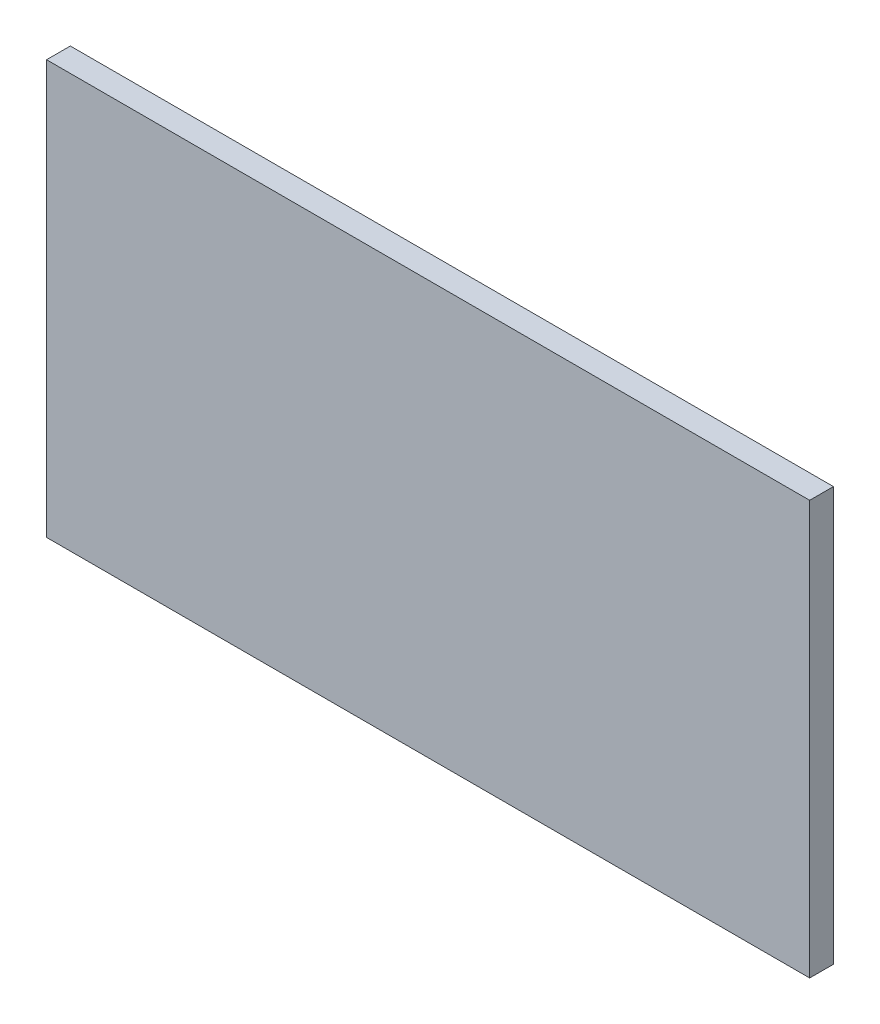
from build123d import *

# Parameters (mm, degrees)
SKETCH_1_W      = 81.566351119
SKETCH_1_H      = 44.220481928
EXTRUDE_1_DEPTH = 2.54


with BuildPart() as part:
    # 草圖1 → 填料-伸長1 (new body)
    with BuildSketch(Plane.XY):
        with Locations((19.237102703, 4.83080895)):
            Rectangle(SKETCH_1_W, SKETCH_1_H)
    extrude(amount=EXTRUDE_1_DEPTH)


solid = part.part
